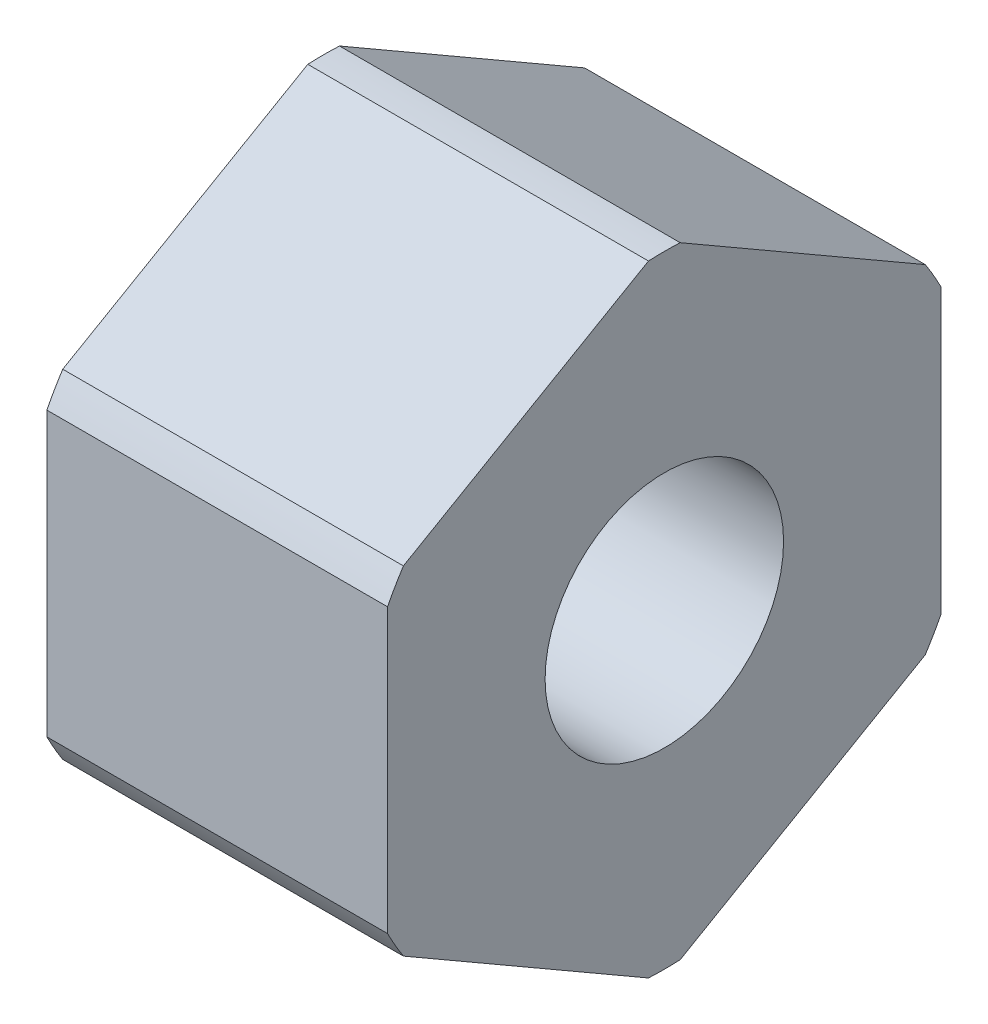
from build123d import *

# Parameters (mm, degrees)
SKETCH_2_OUTSIDE_W  = 11.514
SKETCH_2_OUTSIDE_H  = 11.514
CUT_EXTRUDE_1_DEPTH = 10


with BuildPart() as part:
    # 草图1 → 旋转1 (revolve)
    with BuildSketch(Plane.XY, mode=Mode.PRIVATE) as revolve_1_sk:
        Polygon((0, 1.4), (0, 3.65), (-4, 3.65), (-4, 2.1), (-3, 2.1), (-3, 1.4), align=None)
    revolve(revolve_1_sk.sketch.rotate(Axis((-9.405405405, 0, 0), (1, 0, 0)), 90), axis=Axis((-9.405405405, 0, 0), (1, 0, 0)))

    # 草图2 outside → 切除-拉伸1 (cut)
    with BuildSketch(Plane.ZY.offset(4)):
        Rectangle(SKETCH_2_OUTSIDE_W, SKETCH_2_OUTSIDE_H)
        Polygon((0, 3.75277675), (-3.25, 1.876388375), (-3.25, -1.876388375), (0, -3.75277675), (3.25, -1.876388375), (3.25, 1.876388375), align=None, mode=Mode.SUBTRACT)
    extrude(amount=-CUT_EXTRUDE_1_DEPTH, mode=Mode.SUBTRACT)


solid = part.part
